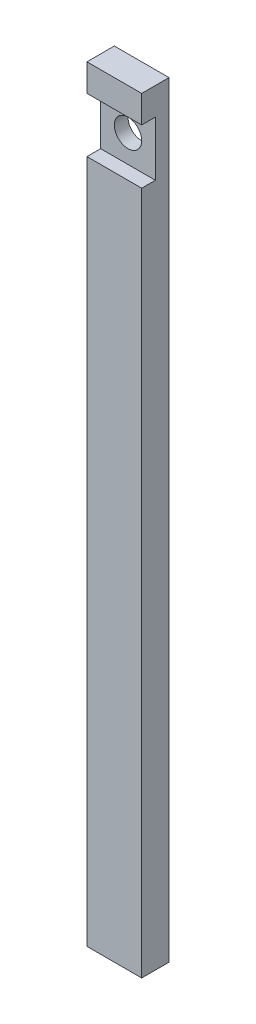
from build123d import *

# Parameters (mm, degrees)
SKETCH1_W           = 25.4
SKETCH1_H           = 12.7
BOSS_EXTRUDE1_DEPTH = 355.6
SKETCH2_W           = 6.35
SKETCH2_H           = 25.4
CUT_EXTRUDE1_DEPTH  = 357.732126392
SKETCH3_R           = 6.35
CUT_EXTRUDE2_DEPTH  = 357.562536591


with BuildPart() as part:
    # Sketch1 → Boss-Extrude1 (new body)
    with BuildSketch(Plane(origin=(0, 0, 0), x_dir=(1, 0, 0), z_dir=(0, 1, 0))):
        with Locations((12.7, 6.35)):
            Rectangle(SKETCH1_W, SKETCH1_H)
    extrude(amount=BOSS_EXTRUDE1_DEPTH)

    # Sketch2 → Cut-Extrude1 (cut, through all)
    with BuildSketch(Plane(origin=(25.4, 0, 0), x_dir=(0, 0, -1), z_dir=(1, 0, 0))):
        with Locations((3.175, 330.2)):
            Rectangle(SKETCH2_W, SKETCH2_H)
    extrude(amount=-CUT_EXTRUDE1_DEPTH, mode=Mode.SUBTRACT)

    # Sketch3 → Cut-Extrude2 (cut, through all)
    with BuildSketch(Plane.XY.offset(-6.35)):
        with Locations((12.7, 330.2)):
            Circle(SKETCH3_R)
    extrude(amount=-CUT_EXTRUDE2_DEPTH, mode=Mode.SUBTRACT)


solid = part.part
